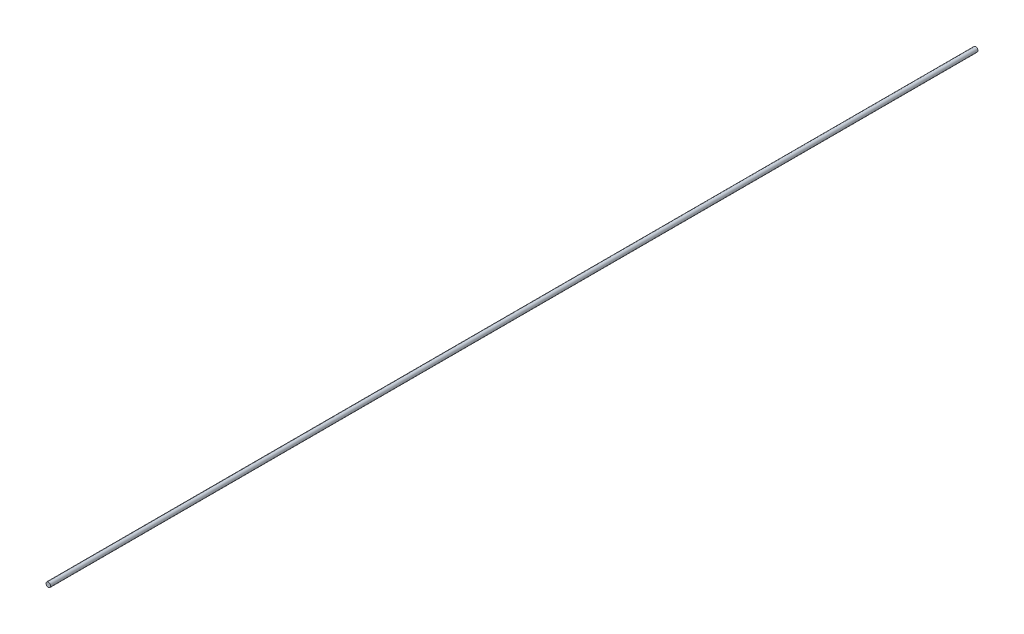
from build123d import *

# Parameters (mm, degrees)
SKETCH1_R           = 0.25
BOSS_EXTRUDE1_DEPTH = 100


with BuildPart() as part:
    # Sketch1 → Boss-Extrude1 (new body)
    with BuildSketch(Plane.XY):
        Circle(SKETCH1_R)
    extrude(amount=BOSS_EXTRUDE1_DEPTH)


solid = part.part
